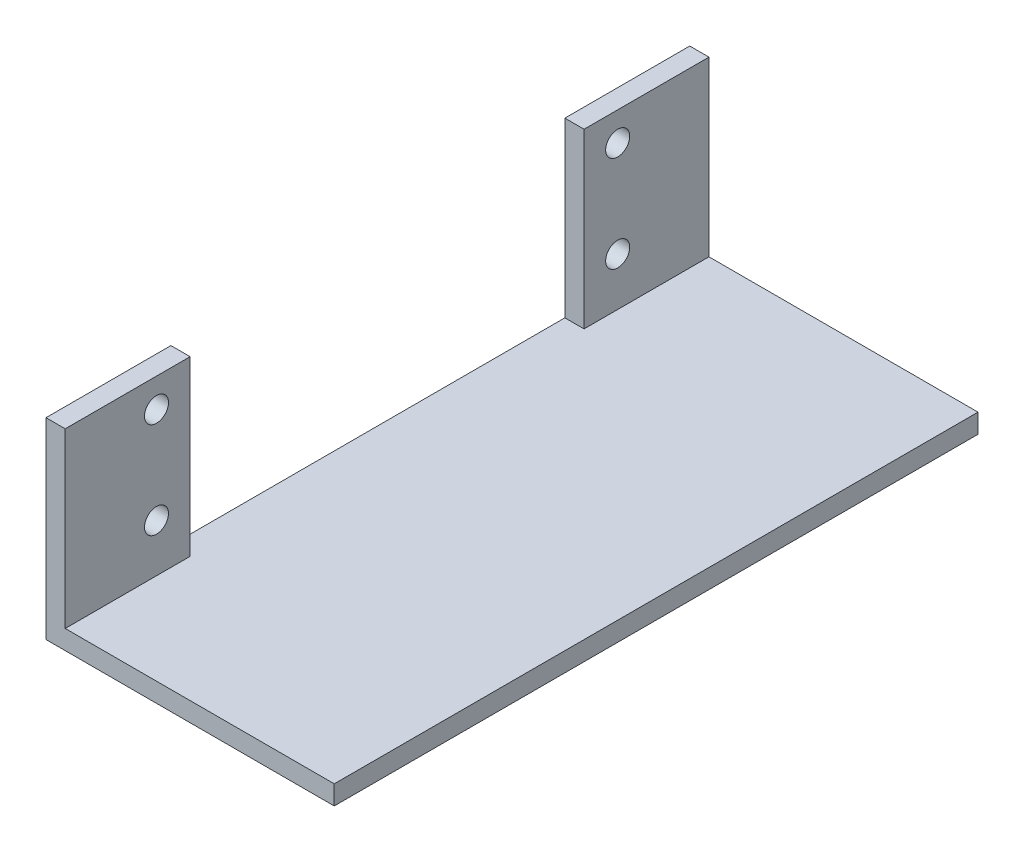
from build123d import *

# Parameters (mm, degrees)
EXTRU_MINCE1_DEPTH      = 33.5
ESQUISSE2_R             = 1.25
ESQUISSE2_W             = 41
ESQUISSE2_H             = 18
ENL_V_MAT_EXTRU_1_DEPTH = 2


with BuildPart() as part:
    # Esquisse1 → Extru.-Mince1 (new, symmetric)
    with BuildSketch(Plane.XY):
        Polygon((0, 20), (0, 0), (30, 0), (30, 2), (2, 2), (2, 20), align=None)
    extrude(amount=EXTRU_MINCE1_DEPTH, both=True)

    # Esquisse2 → Enlèv. mat.-Extru.1 (cut)
    with BuildSketch(Plane.ZY):
        with Locations((-24, 7)):
            Circle(ESQUISSE2_R)
        with Locations((24, 7)):
            Circle(ESQUISSE2_R)
        with Locations((24, 17)):
            Circle(ESQUISSE2_R)
        with Locations((-24, 17)):
            Circle(ESQUISSE2_R)
        with Locations((0, 11)):
            Rectangle(ESQUISSE2_W, ESQUISSE2_H)
    extrude(amount=-ENL_V_MAT_EXTRU_1_DEPTH, mode=Mode.SUBTRACT)


solid = part.part
